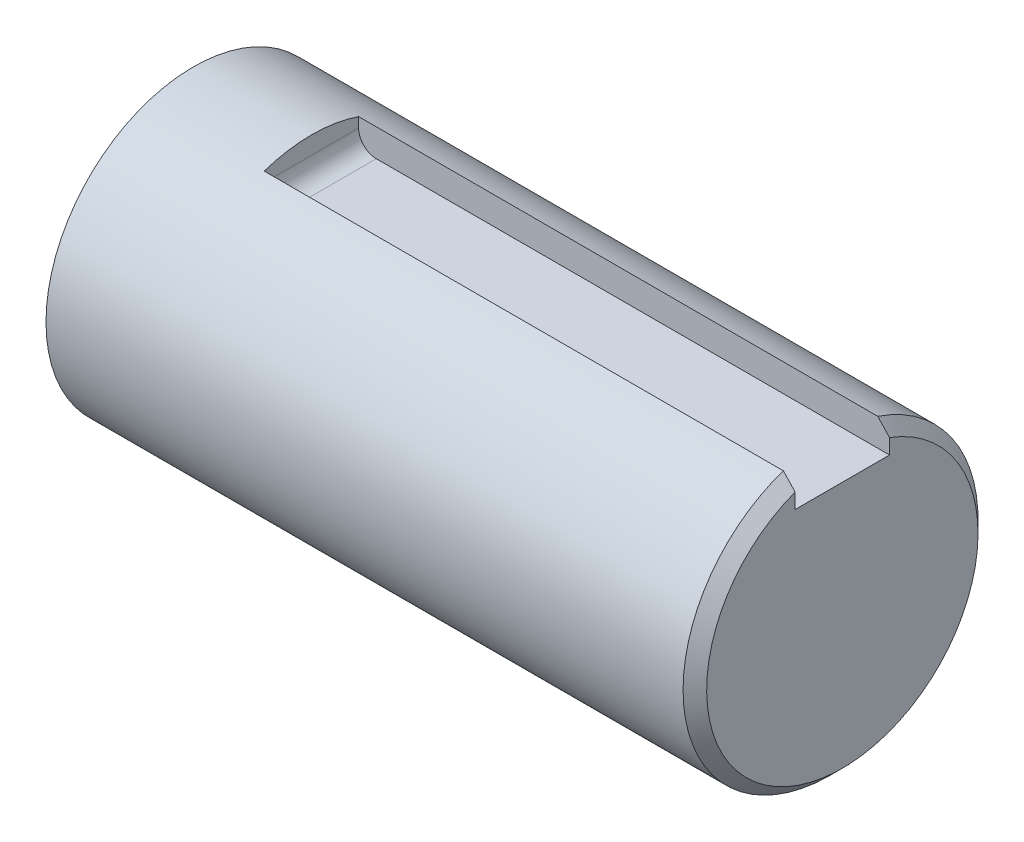
from build123d import *

# Parameters (mm, degrees)
SKETCH1_W          = 110
SKETCH1_H          = 25
SKETCH2_W          = 16
SKETCH2_H          = 11.86901723
CUT_EXTRUDE1_DEPTH = 90
CHAMFER1_SIZE      = 2
FILLET1_R          = 3


with BuildPart() as part:
    # Sketch1 → Revolve1 (revolve)
    with BuildSketch(Plane.XY, mode=Mode.PRIVATE) as revolve1_sk:
        with Locations((0, 12.5)):
            Rectangle(SKETCH1_W, SKETCH1_H)
    revolve(revolve1_sk.sketch.rotate(Axis((-55, 0, 0), (1, 0, 0)), 90), axis=Axis((-55, 0, 0), (1, 0, 0)))

    # Sketch2 → Cut-Extrude1 (cut)
    with BuildSketch(Plane(origin=(55, 0, 0), x_dir=(0, 0, -1), z_dir=(1, 0, 0))):
        with Locations((0, 24.934508615)):
            Rectangle(SKETCH2_W, SKETCH2_H)
    extrude(amount=-CUT_EXTRUDE1_DEPTH, mode=Mode.SUBTRACT)

    # Chamfer1
    chamfer1_edges = [part.edges().sort_by_distance(p)[0] for p in [
        (55, -20.310096012, -14.577379737),
    ]]
    chamfer(chamfer1_edges, length=CHAMFER1_SIZE)

    # Fillet1
    fillet1_edges = [part.edges().sort_by_distance(p)[0] for p in [
        (-35, 19, 0),
    ]]
    fillet(fillet1_edges, radius=FILLET1_R)


solid = part.part
